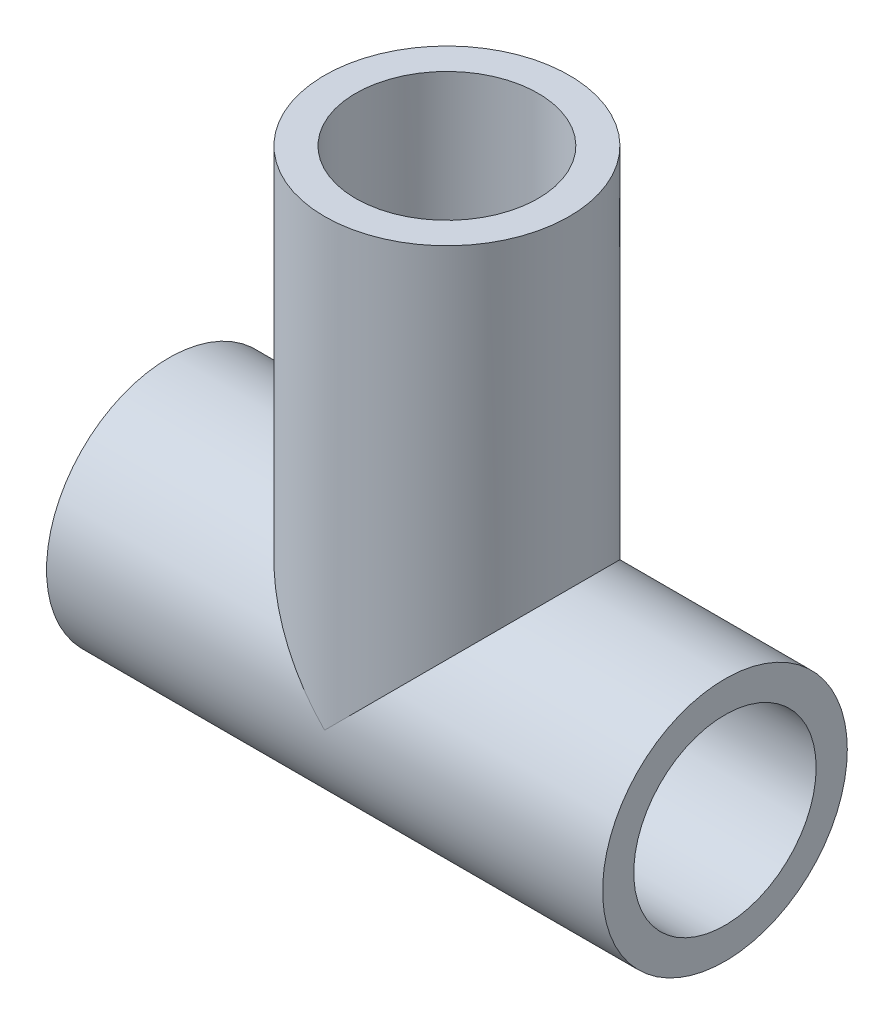
from build123d import *
from build123d.topology import SkipClean

# Parameters (mm, degrees)
SKETCH_1_R          = 5.5
SKETCH_1_R_2        = 4.1
EXTRUDE_1_DEPTH     = 12.5
SKETCH_3_R          = 5.5
EXTRUDE_2_DEPTH     = 20
SKETCH_4_R          = 4.1
CUT_EXTRUDE_2_DEPTH = 22.5
SKETCH_5_R          = 4.1
CUT_EXTRUDE_3_DEPTH = 45


with BuildPart() as part:
    # 草图1 → 凸台-拉伸1 (new, symmetric)
    with BuildSketch(Plane(origin=(0, 0, 0), x_dir=(0, 0, -1), z_dir=(1, 0, 0))):
        Circle(SKETCH_1_R)
        Circle(SKETCH_1_R_2, mode=Mode.SUBTRACT)
    extrude(amount=EXTRUDE_1_DEPTH, both=True)

    # 草图3 → 凸台-拉伸2 (add)
    with BuildSketch(Plane(origin=(0, 0, 0), x_dir=(1, 0, 0), z_dir=(0, 1, 0))):
        with Locations(Location((0, 0, 0), (0, 0, 270))):
            Circle(SKETCH_3_R)
    extrude(amount=EXTRUDE_2_DEPTH)

    # 草图4 → 切除-拉伸2 (cut, symmetric)
    with SkipClean():  # the faces are left unmerged after this step: merging them gives an invalid solid
        with BuildSketch(Plane(origin=(0, 0, 0), x_dir=(0, 0, -1), z_dir=(1, 0, 0))):
            Circle(SKETCH_4_R)
        extrude(amount=CUT_EXTRUDE_2_DEPTH, both=True, mode=Mode.SUBTRACT)

    # 草图5 → 切除-拉伸3 (cut)
    with BuildSketch(Plane(origin=(0, 0, 0), x_dir=(1, 0, 0), z_dir=(0, 1, 0))):
        with Locations(Location((0, 0, 0), (0, 0, 270))):
            Circle(SKETCH_5_R)
    extrude(amount=CUT_EXTRUDE_3_DEPTH, mode=Mode.SUBTRACT)


solid = part.part
